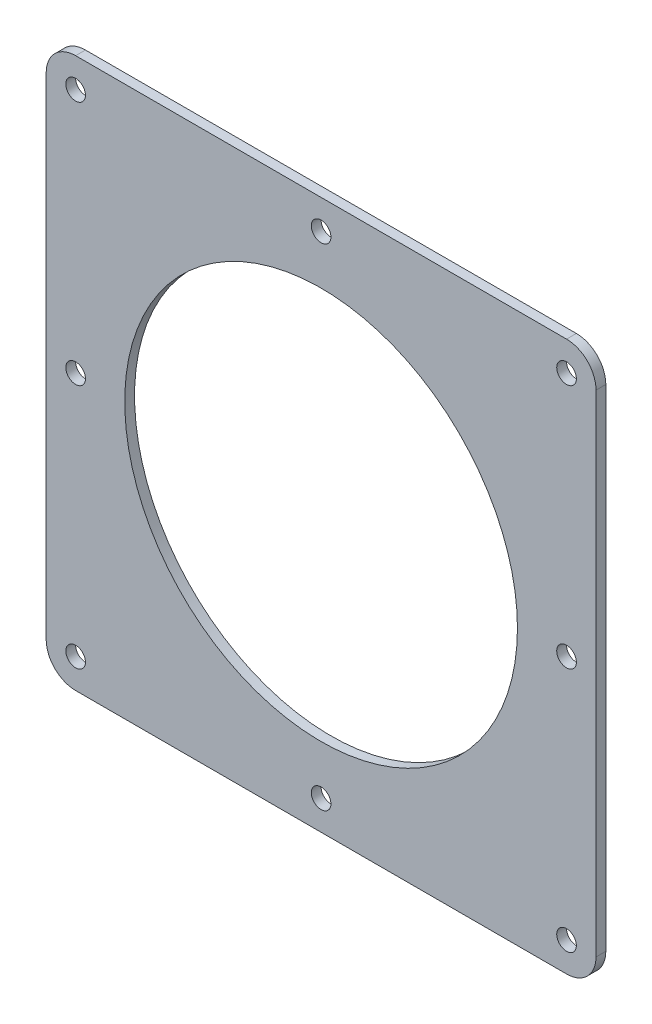
from build123d import *

# Parameters (mm, degrees)
SKETCH2_R           = 5
SKETCH2_R_2         = 4
BOSS_EXTRUDE1_DEPTH = 5
SKETCH7_R           = 100
CUT_EXTRUDE2_DEPTH  = 10


with BuildPart() as part:
    # Sketch2 → Boss-Extrude1 (new body)
    with BuildSketch(Plane.XY):
        with BuildLine():
            Line((-125, 140), (125, 140))
            ThreePointArc((125, 140), (135.606601718, 135.606601718), (140, 125))
            Line((140, 125), (140, -125))
            ThreePointArc((140, -125), (135.606601718, -135.606601718), (125, -140))
            Line((125, -140), (-125, -140))
            ThreePointArc((-125, -140), (-135.606601718, -135.606601718), (-140, -125))
            Line((-140, -125), (-140, 125))
            ThreePointArc((-140, 125), (-135.606601718, 135.606601718), (-125, 140))
        make_face()
        with Locations((-125, 125)):
            Circle(SKETCH2_R, mode=Mode.SUBTRACT)
        with Locations((0, 125)):
            Circle(SKETCH2_R, mode=Mode.SUBTRACT)
        with Locations((125, 125)):
            Circle(SKETCH2_R, mode=Mode.SUBTRACT)
        Circle(SKETCH2_R_2, mode=Mode.SUBTRACT)
        with Locations((125, 0)):
            Circle(SKETCH2_R, mode=Mode.SUBTRACT)
        with Locations((-125, 0)):
            Circle(SKETCH2_R, mode=Mode.SUBTRACT)
        with Locations((-125, -125)):
            Circle(SKETCH2_R, mode=Mode.SUBTRACT)
        with Locations((0, -125)):
            Circle(SKETCH2_R, mode=Mode.SUBTRACT)
        with Locations((125, -125)):
            Circle(SKETCH2_R, mode=Mode.SUBTRACT)
    extrude(amount=BOSS_EXTRUDE1_DEPTH)

    # Sketch7 → Cut-Extrude2 (cut)
    with BuildSketch(Plane.XY.offset(5)):
        Circle(SKETCH7_R)
    extrude(amount=-CUT_EXTRUDE2_DEPTH, mode=Mode.SUBTRACT)


solid = part.part
